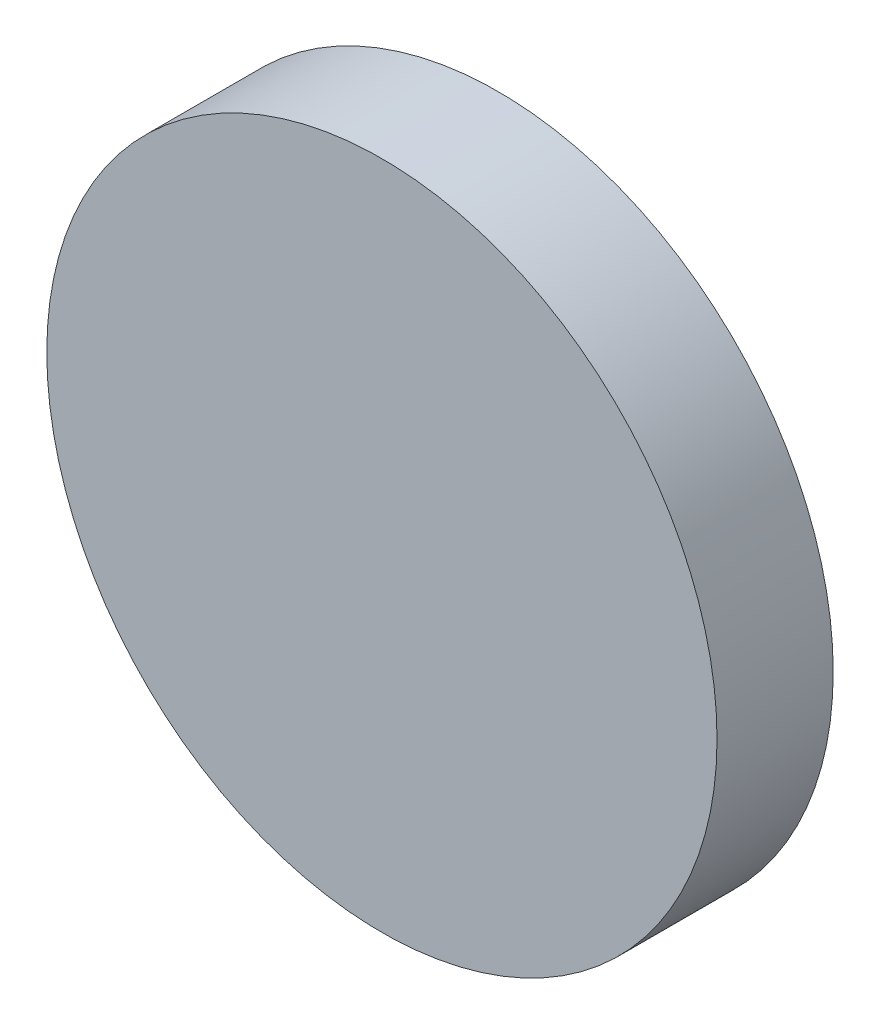
from build123d import *

# Parameters (mm, degrees)
SKETCH1_R           = 47.625
BOSS_EXTRUDE1_DEPTH = 3.81
BOSS_EXTRUDE2_START = 12.7
SKETCH4_R           = 47.625
SKETCH4_R_2         = 44.45
BOSS_EXTRUDE2_DEPTH = 12.7


with BuildPart() as part:
    # Sketch1 → Boss-Extrude1 (new body)
    with BuildSketch(Plane.XY):
        with Locations(Location((0, 0, 0), (0, 0, 180))):
            Circle(SKETCH1_R)
    extrude(amount=BOSS_EXTRUDE1_DEPTH)

    # Sketch4 → Boss-Extrude2 (add)
    with BuildSketch(Plane(origin=(0, 0, 0), x_dir=(-1, 0, 0), z_dir=(0, 0, -1)).offset(BOSS_EXTRUDE2_START)):
        Circle(SKETCH4_R)
        with Locations(Location((0, 0, 0), (0, 0, 180))):
            Circle(SKETCH4_R_2, mode=Mode.SUBTRACT)
    extrude(amount=-BOSS_EXTRUDE2_DEPTH)


solid = part.part
